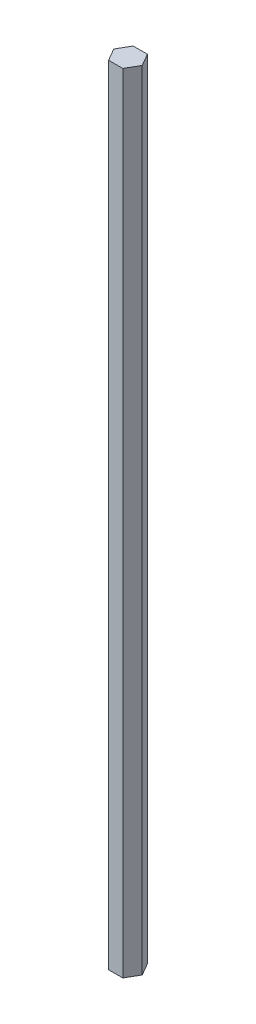
from build123d import *

# Parameters (mm, degrees)
BOSS_EXTRUDE1_DEPTH = 406.4


with BuildPart() as part:
    # Sketch1 → Boss-Extrude1 (new body)
    with BuildSketch(Plane(origin=(0, 0, 0), x_dir=(1, 0, 0), z_dir=(0, 1, 0))):
        Polygon((7.332348419, 0), (3.666174209, 6.35), (-3.666174209, 6.35), (-7.332348419, 0), (-3.666174209, -6.35), (3.666174209, -6.35), align=None)
    extrude(amount=BOSS_EXTRUDE1_DEPTH)


solid = part.part
